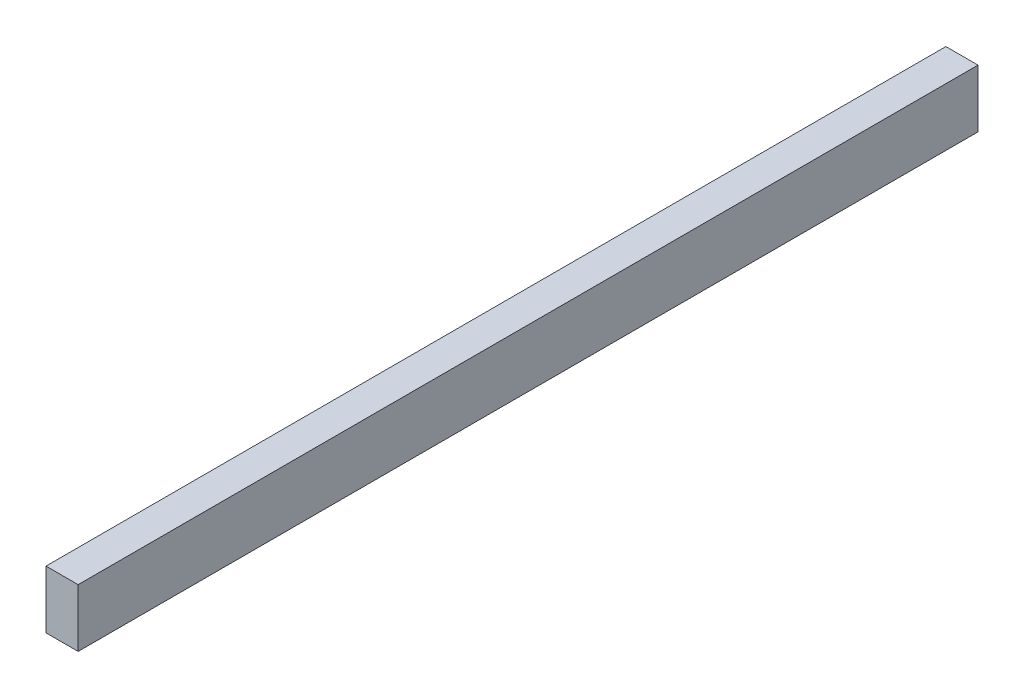
from build123d import *

# Parameters (mm, degrees)
ESQUISSE1_W        = 25
ESQUISSE1_H        = 45
BOSS_EXTRU_1_DEPTH = 700


with BuildPart() as part:
    # Esquisse1 → Boss.-Extru.1 (new body)
    with BuildSketch(Plane.XY):
        with Locations((12.5, 22.5)):
            Rectangle(ESQUISSE1_W, ESQUISSE1_H)
    extrude(amount=BOSS_EXTRU_1_DEPTH)


solid = part.part
